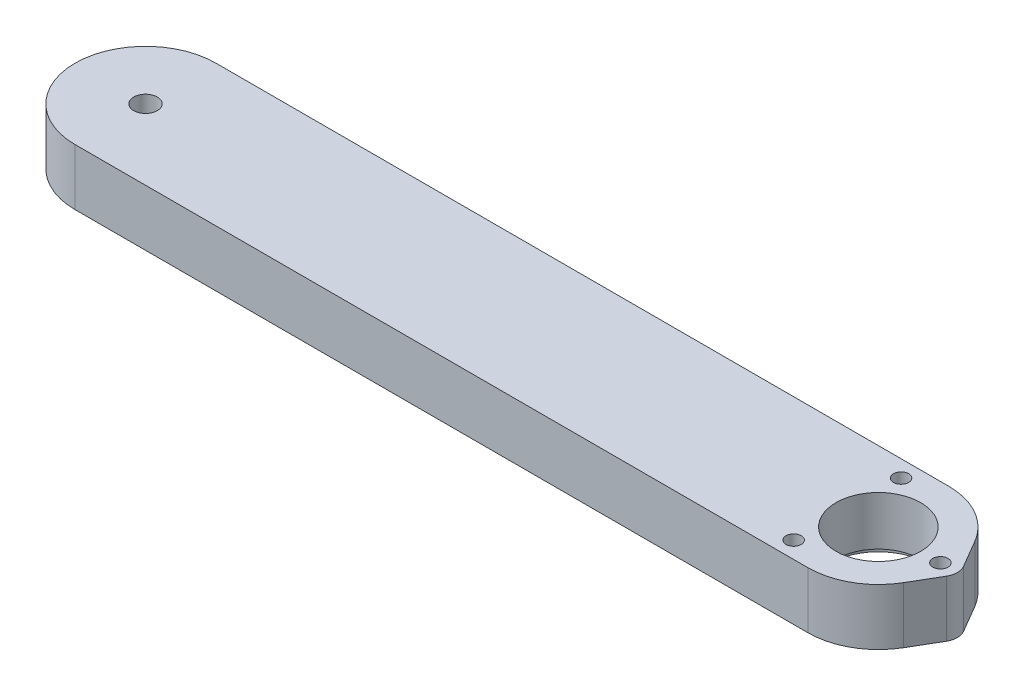
from build123d import *

# Parameters (mm, degrees)
EXTRUDE_1_DEPTH     = 10
EXTRUDE_5_DEPTH     = 10
CUT_EXTRUDE_2_REACH = 82.606
SKETCH_7_R          = 7.5
SKETCH_8_R          = 8.75
CUT_EXTRUDE_3_DEPTH = 1.3
CUT_EXTRUDE_4_REACH = 82.606
SKETCH_9_R          = 1.35
CUT_EXTRUDE_5_REACH = 82.606
SKETCH_12_R         = 2.1


with BuildPart() as part:
    # 草图1 → 凸台-拉伸1 (new body)
    with BuildSketch(Plane(origin=(0, 0, 0), x_dir=(1, 0, 0), z_dir=(0, 1, 0))):
        with BuildLine():
            Line((-65, 12.5), (65, 12.5))
            ThreePointArc((65, 12.5), (77.5, 0), (65, -12.5))
            Line((65, -12.5), (-65, -12.5))
            ThreePointArc((-65, -12.5), (-77.5, 0), (-65, 12.5))
        make_face()
    extrude(amount=EXTRUDE_1_DEPTH)

    # 草图10 → 凸台-拉伸5 (add)
    with BuildSketch(Plane.XZ):
        with BuildLine():
            Line((75.795454545, -6.301441197), (78.590909091, -1.512345887))
            ThreePointArc((78.590909091, -1.512345887), (79, 0), (78.590909091, 1.512345887))
            Line((78.590909091, 1.512345887), (75.795454545, 6.301441197))
            Line((75.795454545, 6.301441197), (75.795454545, -6.301441197))
        make_face()
    extrude(amount=-EXTRUDE_5_DEPTH)

    # 草图7 → 切除-拉伸2 (cut, up to next)
    with BuildSketch(Plane(origin=(0, 10, 0), x_dir=(1, 0, 0), z_dir=(0, 1, 0)), mode=Mode.PRIVATE) as cut_extrude_2_sk1:
        with Locations(Location((65, 0, 0), (0, 0, 270))):
            Circle(SKETCH_7_R)
    cut_extrude_2_tool1 = extrude(cut_extrude_2_sk1.sketch, amount=-CUT_EXTRUDE_2_REACH, mode=Mode.PRIVATE) & part.part
    add(cut_extrude_2_tool1.solids().sort_by_distance((65, 10, 0))[0], mode=Mode.SUBTRACT)

    # 草图8 → 切除-拉伸3 (cut)
    with BuildSketch(Plane(origin=(0, 0, 0), x_dir=(1, 0, 0), z_dir=(0, 1, 0))):
        with Locations(Location((65, 0, 0), (0, 0, 270))):
            Circle(SKETCH_8_R)
    extrude(amount=CUT_EXTRUDE_3_DEPTH, mode=Mode.SUBTRACT)

    # 草图9 → 切除-拉伸4 (cut, up to next)
    with BuildSketch(Plane.XZ, mode=Mode.PRIVATE) as cut_extrude_4_sk1:
        with Locations(Location((59.5, 9.526279442, 0), (0, 0, 270))):
            Circle(SKETCH_9_R)
    cut_extrude_4_tool1 = extrude(cut_extrude_4_sk1.sketch, amount=-CUT_EXTRUDE_4_REACH, mode=Mode.PRIVATE) & part.part
    # 草图9 → 切除-拉伸4 (cut, up to next)
    with BuildSketch(Plane.XZ, mode=Mode.PRIVATE) as cut_extrude_4_sk2:
        with Locations(Location((76, 0, 0), (0, 0, 270))):
            Circle(SKETCH_9_R)
    cut_extrude_4_tool2 = extrude(cut_extrude_4_sk2.sketch, amount=-CUT_EXTRUDE_4_REACH, mode=Mode.PRIVATE) & part.part
    # 草图9 → 切除-拉伸4 (cut, up to next)
    with BuildSketch(Plane.XZ, mode=Mode.PRIVATE) as cut_extrude_4_sk3:
        with Locations(Location((59.5, -9.526279442, 0), (0, 0, 270))):
            Circle(SKETCH_9_R)
    cut_extrude_4_tool3 = extrude(cut_extrude_4_sk3.sketch, amount=-CUT_EXTRUDE_4_REACH, mode=Mode.PRIVATE) & part.part
    add(cut_extrude_4_tool1.solids().sort_by_distance((59.5, 0, 9.526279))[0], mode=Mode.SUBTRACT)
    add(cut_extrude_4_tool2.solids().sort_by_distance((76, 0, 0))[0], mode=Mode.SUBTRACT)
    add(cut_extrude_4_tool3.solids().sort_by_distance((59.5, 0, -9.526279))[0], mode=Mode.SUBTRACT)

    # 草图12 → 切除-拉伸5 (cut, up to next)
    with BuildSketch(Plane(origin=(0, 10, 0), x_dir=(1, 0, 0), z_dir=(0, 1, 0)), mode=Mode.PRIVATE) as cut_extrude_5_sk1:
        with Locations(Location((-65, 0, 0), (0, 0, 270))):
            Circle(SKETCH_12_R)
    cut_extrude_5_tool1 = extrude(cut_extrude_5_sk1.sketch, amount=-CUT_EXTRUDE_5_REACH, mode=Mode.PRIVATE) & part.part
    add(cut_extrude_5_tool1.solids().sort_by_distance((-65, 10, 0))[0], mode=Mode.SUBTRACT)


solid = part.part
